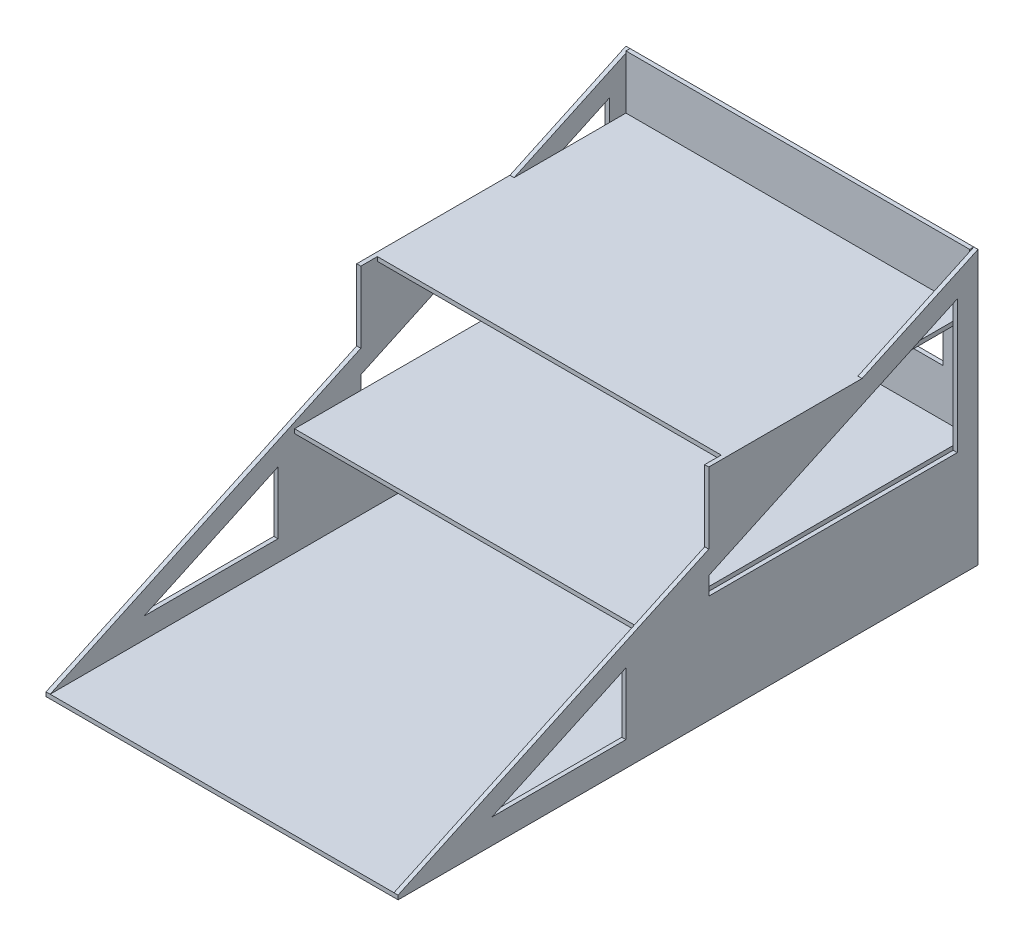
from build123d import *

# Parameters (mm, degrees)
SKETCH1_W           = 215.9
SKETCH1_H           = 355.6
BOSS_EXTRUDE1_DEPTH = 2.54
BOSS_EXTRUDE2_DEPTH = 2.54
CUT_EXTRUDE4_DEPTH  = 2.54
BOSS_EXTRUDE3_DEPTH = 2.54
CUT_EXTRUDE5_DEPTH  = 2.54
SKETCH7_W           = 210.82
SKETCH7_H           = 165.1
SKETCH7_W_2         = 177.8
SKETCH7_H_2         = 31.75
BOSS_EXTRUDE4_DEPTH = 2.54
SKETCH8_W           = 210.82
SKETCH8_H           = 2.54
BOSS_EXTRUDE6_DEPTH = 203.2
SKETCH9_W           = 210.82
SKETCH9_H           = 2.54
BOSS_EXTRUDE7_DEPTH = 152.4
BOSS_EXTRUDE8_START = -2.54
BOSS_EXTRUDE8_DEPTH = 2.54
BOSS_EXTRUDE9_START = -2.54
BOSS_EXTRUDE9_DEPTH = 2.54


with BuildPart() as part:
    # Sketch1 → Boss-Extrude1 (new body)
    with BuildSketch(Plane(origin=(0, 0, 0), x_dir=(1, 0, 0), z_dir=(0, 1, 0))):
        with Locations((107.95, 177.8)):
            Rectangle(SKETCH1_W, SKETCH1_H)
    extrude(amount=BOSS_EXTRUDE1_DEPTH)

    # Sketch2 → Boss-Extrude2 (add)
    with BuildSketch(Plane(origin=(215.9, 0, 0), x_dir=(0, 0, -1), z_dir=(1, 0, 0))):
        Polygon((355.6, 2.54), (355.6, 167.64), (0, 2.54), align=None)
    extrude(amount=-BOSS_EXTRUDE2_DEPTH)

    # Sketch3 → Cut-Extrude4 (cut)
    with BuildSketch(Plane(origin=(215.9, 0, 0), x_dir=(0, 0, -1), z_dir=(1, 0, 0))):
        Polygon((139.7, 15.24), (57.51214351, 15.24), (139.7, 53.398647656), align=None)
        Polygon((190.5, 66.04), (190.5, 76.984361942), (342.9, 147.741504799), (342.9, 66.04), align=None)
    extrude(amount=-CUT_EXTRUDE4_DEPTH, mode=Mode.SUBTRACT)

    # Sketch5 → Boss-Extrude3 (add)
    with BuildSketch(Plane.ZY):
        Polygon((0, 2.54), (-355.6, 167.64), (-355.6, 2.54), align=None)
    extrude(amount=-BOSS_EXTRUDE3_DEPTH)

    # Sketch6 → Cut-Extrude5 (cut)
    with BuildSketch(Plane.ZY):
        Polygon((-139.7, 15.24), (-57.51214351, 15.24), (-139.7, 53.398647656), align=None)
        Polygon((-342.9, 66.04), (-190.5, 66.04), (-190.5, 76.984361942), (-342.9, 147.741504799), align=None)
    extrude(amount=-CUT_EXTRUDE5_DEPTH, mode=Mode.SUBTRACT)

    # Sketch7 → Boss-Extrude4 (add)
    with BuildSketch(Plane(origin=(0, 0, -355.6), x_dir=(-1, 0, 0), z_dir=(0, 0, -1))):
        with Locations((-107.95, 85.09)):
            Rectangle(SKETCH7_W, SKETCH7_H)
        with Locations((-107.95, 31.115)):
            Rectangle(SKETCH7_W_2, SKETCH7_H_2, mode=Mode.SUBTRACT)
        with Locations((-107.95, 113.665)):
            Rectangle(SKETCH7_W_2, SKETCH7_H_2, mode=Mode.SUBTRACT)
    extrude(amount=-BOSS_EXTRUDE4_DEPTH)

    # Sketch9 → Boss-Extrude7 (add)
    with BuildSketch(Plane.XY.offset(-353.06)):
        with Locations((107.95, 133.35)):
            Rectangle(SKETCH9_W, SKETCH9_H)
    extrude(amount=BOSS_EXTRUDE7_DEPTH)

    # Sketch10 → Boss-Extrude8 (add)
    with BuildSketch(Plane(origin=(215.9, 0, 0), x_dir=(0, 0, -1), z_dir=(1, 0, 0)).offset(BOSS_EXTRUDE8_START)):
        Polygon((284.48, 134.62), (190.5, 134.62), (190.5, 90.986428571), align=None)
    extrude(amount=BOSS_EXTRUDE8_DEPTH)

    # Sketch11 → Boss-Extrude9 (add)
    with BuildSketch(Plane.ZY.offset(BOSS_EXTRUDE9_START)):
        Polygon((-190.5, 134.62), (-284.48, 134.62), (-190.5, 90.986428571), align=None)
    extrude(amount=BOSS_EXTRUDE9_DEPTH)


with BuildPart() as body_2:
    # Sketch8 → Boss-Extrude6 (new body)
    with BuildSketch(Plane.XY.offset(-353.06)):
        with Locations((107.95, 67.31)):
            Rectangle(SKETCH8_W, SKETCH8_H)
    extrude(amount=BOSS_EXTRUDE6_DEPTH)


solid = Compound([part.part, body_2.part])
